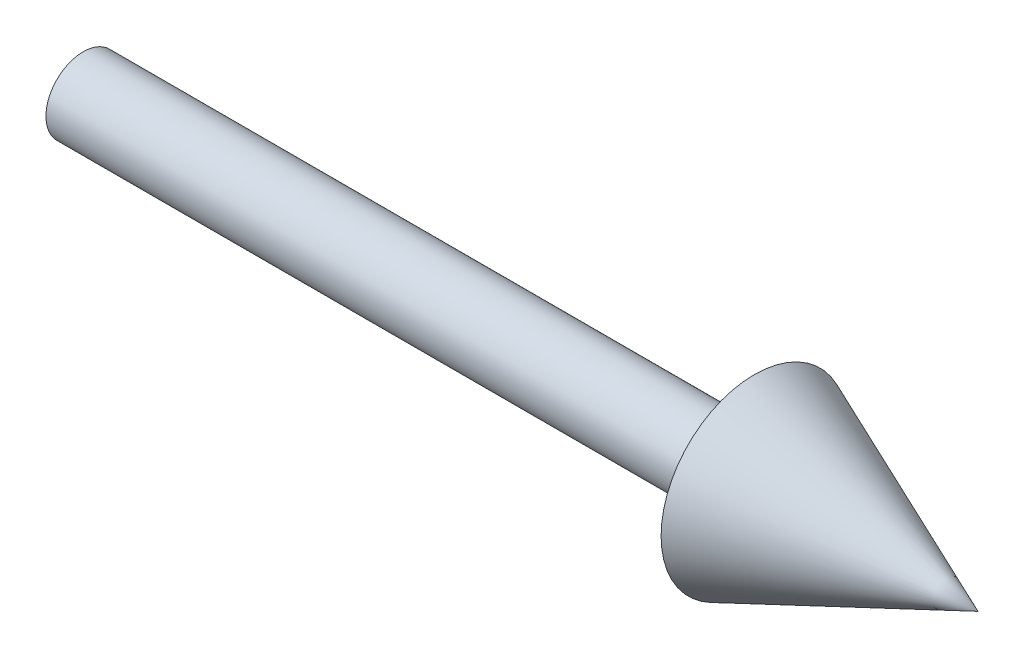
from build123d import *


with BuildPart() as part:
    # Sketch1 → Revolve1 (revolve)
    with BuildSketch(Plane.XY, mode=Mode.PRIVATE) as revolve1_sk:
        Polygon((0, 0), (0, 5), (90, 5), (90, 12.5), (120, 0), align=None)
    revolve(revolve1_sk.sketch.rotate(Axis((0, 0, 0), (-1, 0, 0)), 90), axis=Axis((0, 0, 0), (-1, 0, 0)))


solid = part.part
